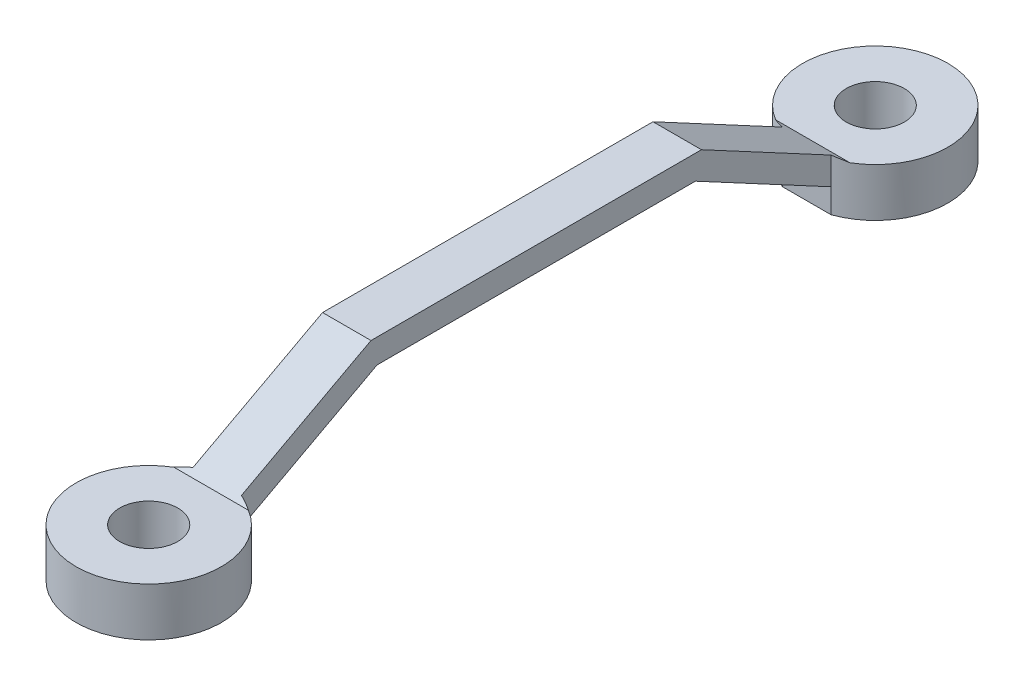
from build123d import *

# Parameters (mm, degrees)
BOSS_EXTRUDE1_DEPTH     = 10
CUT_EXTRUDE1_DEPTH      = 21.976176963
CUT_EXTRUDE1_DEPTH_BACK = 10
SKETCH2_OUTSIDE_W       = 45.568
SKETCH2_OUTSIDE_H       = 19.568
M2_CLEARANCE_HOLE1_D    = 2.4


with BuildPart() as part:
    # Sketch1 → Boss-Extrude1 (new body)
    with BuildSketch(Plane(origin=(0, 0, 0), x_dir=(1, 0, 0), z_dir=(0, 1, 0))):
        with BuildLine():
            Line((2, -12.171572875), (2, 12.171572875))
            ThreePointArc((2, 12.171572875), (1, 18), (0, 12.171572875))
            Line((0, 12.171572875), (0, -12.171572875))
            ThreePointArc((0, -12.171572875), (1, -18), (2, -12.171572875))
        make_face()
    extrude(amount=BOSS_EXTRUDE1_DEPTH)

    # Sketch2 outside → Cut-Extrude1 (cut, two sides: drawn at the far end of the back side and taken through both)
    with BuildSketch(Plane(origin=(2, 0, 0), x_dir=(0, 0, -1), z_dir=(1, 0, 0)).offset(-CUT_EXTRUDE1_DEPTH_BACK)):
        with Locations((0, 5)):
            Rectangle(SKETCH2_OUTSIDE_W, SKETCH2_OUTSIDE_H)
        Polygon((6.57130649, 4), (-6.57130649, 4), (-12.171572875, 1), (-12.171572875, 0), (-18, 0), (-18, 2), (-12.422546375, 2), (-6.822279989, 5), (6.822279989, 5), (12.422546375, 2), (18, 2), (18, 0), (12.171572875, 0), (12.171572875, 1), align=None, mode=Mode.SUBTRACT)
    extrude(amount=CUT_EXTRUDE1_DEPTH + CUT_EXTRUDE1_DEPTH_BACK, mode=Mode.SUBTRACT)

    # M2 Clearance Hole1 (through all)
    with Locations(Plane(origin=(0, 2, 0), x_dir=(1, 0, 0), z_dir=(0, 1, 0))):
        with Locations((1, 15), (1, -15)):
            Hole(M2_CLEARANCE_HOLE1_D / 2)


solid = part.part
